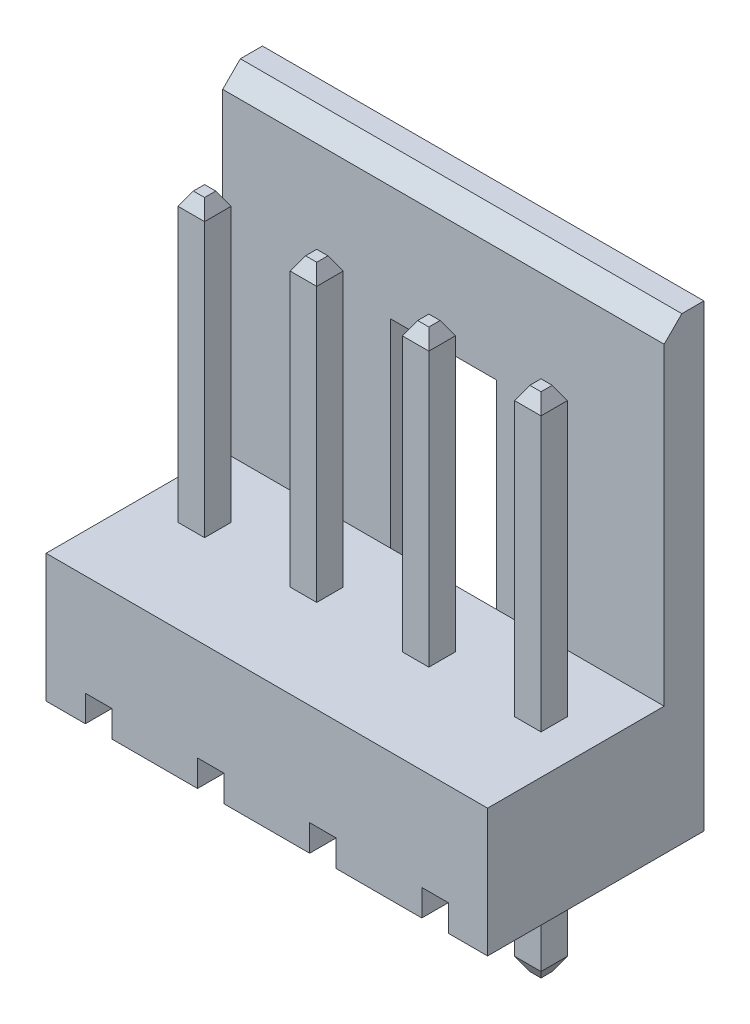
from build123d import *
from OCP.BRepFilletAPI import BRepFilletAPI_MakeChamfer

# Parameters (mm, degrees)
BOSS_EXTRUDE1_DEPTH      = 5
SKETCH2_W                = 0.6
SKETCH2_H                = 0.6
CUT_EXTRUDE1_DEPTH       = 11.259629623
BOSS_EXTRUDE2_DEPTH      = 6.5
BOSS_EXTRUDE2_DEPTH_BACK = 5
SKETCH2_2_W              = 0.6
SKETCH2_2_H              = 0.6
CHAMFER1_SIZE            = 0.3
CHAMFER1_SIZE2           = 0.173205081
LPATTERN1_COUNT          = 4
LPATTERN1_PITCH          = 2.54
SKETCH3_W                = 2.4
SKETCH3_H                = 7.4
CUT_EXTRUDE2_DEPTH       = 0.9
SKETCH4_W                = 0.6
SKETCH4_H                = 0.6
CUT_EXTRUDE3_DEPTH       = 13.536745989


with BuildPart() as part:
    # Sketch1 → Boss-Extrude1 (new, symmetric)
    with BuildSketch(Plane(origin=(0, 0, 0), x_dir=(0, 0, -1), z_dir=(1, 0, 0))):
        Polygon((0, 10.4), (-0.5, 10.4), (-0.9, 10), (-0.9, 2.9), (-4.9, 2.9), (-4.9, 0), (0, 0), align=None)
    extrude(amount=BOSS_EXTRUDE1_DEPTH, both=True)

    # Sketch2 → Cut-Extrude1 (cut, through all)
    with BuildSketch(Plane(origin=(0, 2.9, 0), x_dir=(1, 0, 0), z_dir=(0, 1, 0))):
        with Locations((-3.81, -2.5)):
            Rectangle(SKETCH2_W, SKETCH2_H)
        with Locations((-1.27, -2.5)):
            Rectangle(SKETCH2_W, SKETCH2_H)
        with Locations((1.27, -2.5)):
            Rectangle(SKETCH2_W, SKETCH2_H)
        with Locations((3.81, -2.5)):
            Rectangle(SKETCH2_W, SKETCH2_H)
    extrude(amount=-CUT_EXTRUDE1_DEPTH, mode=Mode.SUBTRACT)

    # Sketch3 → Cut-Extrude2 (cut)
    with BuildSketch(Plane(origin=(0, 0, 0), x_dir=(-1, 0, 0), z_dir=(0, 0, -1))):
        with Locations((0, 3.7)):
            Rectangle(SKETCH3_W, SKETCH3_H)
    extrude(amount=-CUT_EXTRUDE2_DEPTH, mode=Mode.SUBTRACT)

    # Sketch4 → Cut-Extrude3 (cut, through all)
    with BuildSketch(Plane.XY.offset(4.9)):
        with Locations((-3.81, 0.3)):
            Rectangle(SKETCH4_W, SKETCH4_H)
        with Locations((-1.27, 0.3)):
            Rectangle(SKETCH4_W, SKETCH4_H)
        with Locations((1.27, 0.3)):
            Rectangle(SKETCH4_W, SKETCH4_H)
        with Locations((3.81, 0.3)):
            Rectangle(SKETCH4_W, SKETCH4_H)
    extrude(amount=-CUT_EXTRUDE3_DEPTH, mode=Mode.SUBTRACT)


with BuildPart() as body_2:
    # Sketch2<2> → Boss-Extrude2 (new, two sides: drawn at the far end of the back side and taken through both)
    with BuildSketch(Plane(origin=(0, 2.9, 0), x_dir=(1, 0, 0), z_dir=(0, 1, 0)).offset(-BOSS_EXTRUDE2_DEPTH_BACK)):
        with Locations((-3.81, -2.5)):
            Rectangle(SKETCH2_2_W, SKETCH2_2_H)
    extrude(amount=BOSS_EXTRUDE2_DEPTH + BOSS_EXTRUDE2_DEPTH_BACK)

    # Chamfer1: one chamfer whose edges measure the first distance from different faces: ONE call of the kernel's chamfer builder (chamfer() names one face for all edges)
    chamfer1_edges_1 = [body_2.edges().sort_by_distance(p)[0] for p in [
        (-3.81, 9.4, 2.2),
        (-3.81, -2.1, 2.2),
    ]]
    chamfer1_side_1 = [body_2.faces().sort_by_distance(p)[0] for p in [
        (-3.81, 3.65, 2.2),
    ]]
    chamfer1_edges_2 = [body_2.edges().sort_by_distance(p)[0] for p in [
        (-3.51, 9.4, 2.5),
        (-3.51, -2.1, 2.5),
    ]]
    chamfer1_side_2 = [body_2.faces().sort_by_distance(p)[0] for p in [
        (-3.51, 3.65, 2.5),
    ]]
    chamfer1_edges_3 = [body_2.edges().sort_by_distance(p)[0] for p in [
        (-4.11, 9.4, 2.5),
        (-4.11, -2.1, 2.5),
    ]]
    chamfer1_side_3 = [body_2.faces().sort_by_distance(p)[0] for p in [
        (-4.11, 3.65, 2.5),
    ]]
    chamfer1_edges_4 = [body_2.edges().sort_by_distance(p)[0] for p in [
        (-3.81, -2.1, 2.8),
        (-3.81, 9.4, 2.8),
    ]]
    chamfer1_side_4 = [body_2.faces().sort_by_distance(p)[0] for p in [
        (-3.81, 3.65, 2.8),
    ]]
    chamfer1 = BRepFilletAPI_MakeChamfer(body_2.part.solid().wrapped)
    for e in chamfer1_edges_1:
        chamfer1.Add(CHAMFER1_SIZE, CHAMFER1_SIZE2, e.wrapped, chamfer1_side_1[0].wrapped)  # the first distance lies on this face
    for e in chamfer1_edges_2:
        chamfer1.Add(CHAMFER1_SIZE, CHAMFER1_SIZE2, e.wrapped, chamfer1_side_2[0].wrapped)  # the first distance lies on this face
    for e in chamfer1_edges_3:
        chamfer1.Add(CHAMFER1_SIZE, CHAMFER1_SIZE2, e.wrapped, chamfer1_side_3[0].wrapped)  # the first distance lies on this face
    for e in chamfer1_edges_4:
        chamfer1.Add(CHAMFER1_SIZE, CHAMFER1_SIZE2, e.wrapped, chamfer1_side_4[0].wrapped)  # the first distance lies on this face
    add(Compound.cast(chamfer1.Shape()), mode=Mode.REPLACE)


with BuildPart() as lpattern1_1:
    # LPattern1: pattern copy
    add(body_2.part.moved(Location(Vector(1, 0, 0) * (1 * LPATTERN1_PITCH))))


with BuildPart() as lpattern1_2:
    # LPattern1: pattern copy
    add(body_2.part.moved(Location(Vector(1, 0, 0) * (2 * LPATTERN1_PITCH))))


with BuildPart() as lpattern1_3:
    # LPattern1: pattern copy
    add(body_2.part.moved(Location(Vector(1, 0, 0) * (3 * LPATTERN1_PITCH))))


solid = Compound([part.part, body_2.part, lpattern1_1.part, lpattern1_2.part, lpattern1_3.part])
